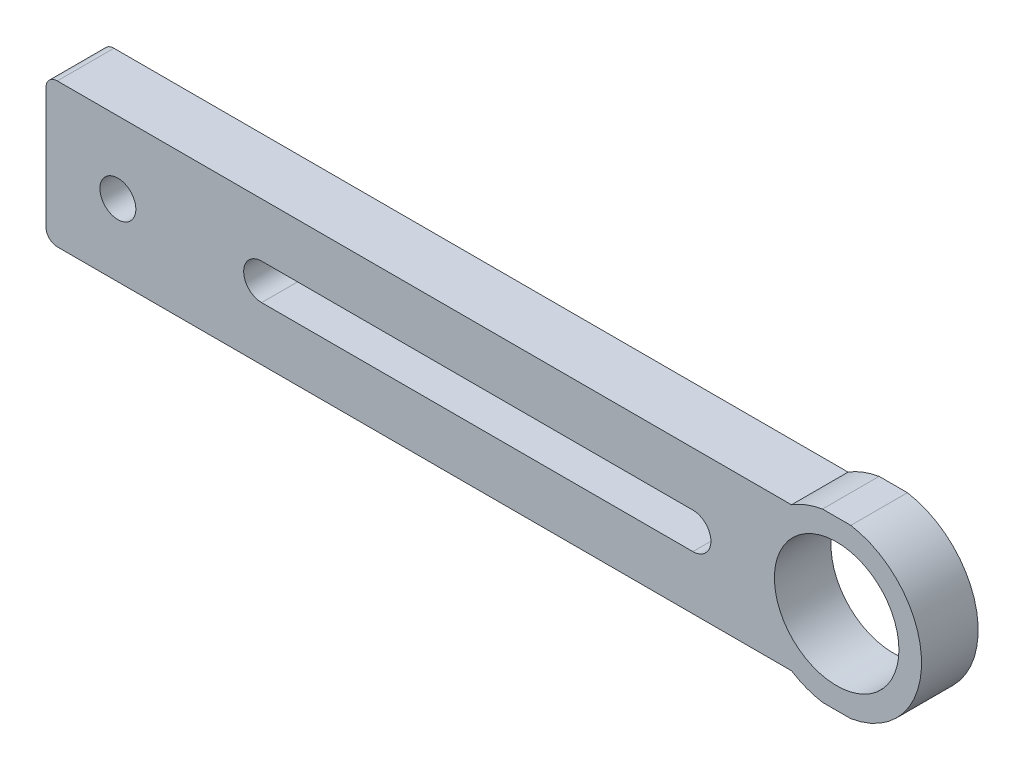
from build123d import *

# Parameters (mm, degrees)
SKETCH1_R           = 3.175
SKETCH1_R_2         = 11
BOSS_EXTRUDE1_DEPTH = 10
FILLET3_R           = 2


with BuildPart() as part:
    # Sketch1 → Boss-Extrude1 (new body)
    with BuildSketch(Plane.XY):
        with BuildLine():
            Line((-69.85, -12.7), (-69.85, 12.7))
            Line((-69.85, 12.7), (61.868145579, 12.7))
            ThreePointArc((61.868145579, 12.7), (64.505886278, 14.015721477), (67.35, 14.790199458))
            Line((67.35, 14.790199458), (72.35, 14.790199458))
            ThreePointArc((72.35, 14.790199458), (84.85, 0), (72.35, -14.790199458))
            Line((72.35, -14.790199458), (67.35, -14.790199458))
            ThreePointArc((67.35, -14.790199458), (64.505886278, -14.015721477), (61.868145579, -12.7))
            Line((61.868145579, -12.7), (-69.85, -12.7))
        make_face()
        with Locations((-57.15, 0)):
            Circle(SKETCH1_R, mode=Mode.SUBTRACT)
        with Locations((69.85, 0)):
            Circle(SKETCH1_R_2, mode=Mode.SUBTRACT)
        with BuildLine():
            Line((-31.75, 3.175), (44.45, 3.175))
            ThreePointArc((44.45, 3.175), (47.625, 0), (44.45, -3.175))
            Line((44.45, -3.175), (-31.75, -3.175))
            ThreePointArc((-31.75, -3.175), (-34.925, 0), (-31.75, 3.175))
        make_face(mode=Mode.SUBTRACT)
    extrude(amount=BOSS_EXTRUDE1_DEPTH)

    # Fillet3
    fillet3_edges = [part.edges().sort_by_distance(p)[0] for p in [
        (-69.85, -12.7, 5),
        (-69.85, 12.7, 5),
    ]]
    fillet(fillet3_edges, radius=FILLET3_R)


solid = part.part
